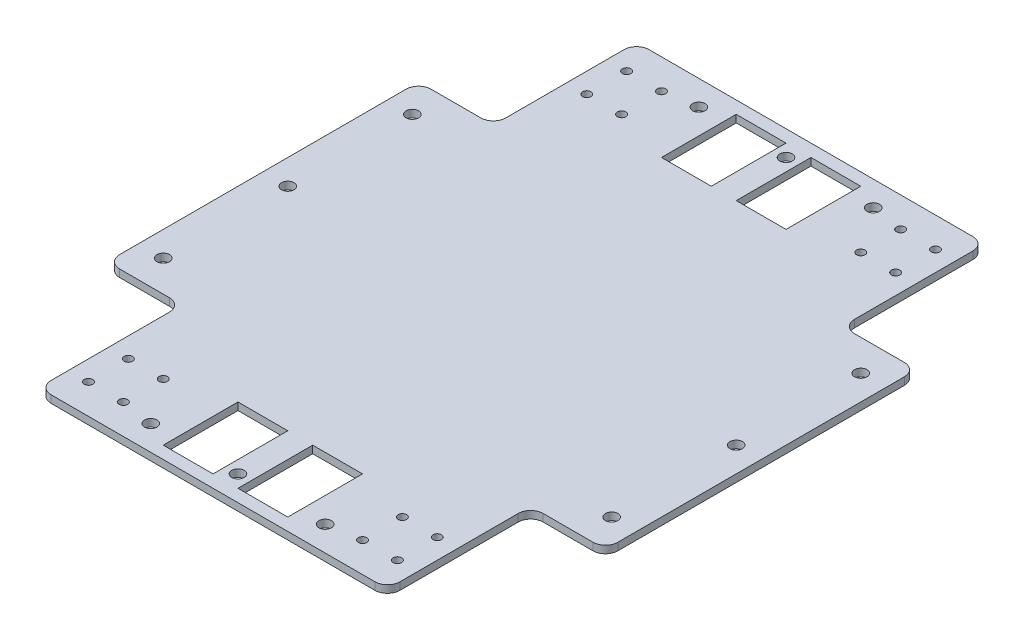
from build123d import *

# Parameters (mm, degrees)
SKETCH_1_R          = 1.7
SKETCH_1_R_2        = 2.5
SKETCH_1_W          = 20
SKETCH_1_H          = 30
EXTRUDE_2_DEPTH     = 3
SKETCH_3_W          = 30
SKETCH_3_H          = 10
CUT_EXTRUDE_2_DEPTH = 3


with BuildPart() as part:
    # 草图1 → 凸台-拉伸2 (new body)
    with BuildSketch(Plane(origin=(0, 0, 0), x_dir=(1, 0, 0), z_dir=(0, 1, 0))):
        with BuildLine():
            Line((-75, 80), (-95, 80))
            ThreePointArc((-95, 80), (-98.535533906, 78.535533906), (-100, 75))
            Line((-100, 75), (-100, -75))
            ThreePointArc((-100, -75), (-98.535533906, -78.535533906), (-95, -80))
            Line((-95, -80), (-75, -80))
            ThreePointArc((-75, -80), (-71.464466094, -81.464466094), (-70, -85))
            Line((-70, -85), (-70, -115))
            ThreePointArc((-70, -115), (-68.535533906, -118.535533906), (-65, -120))
            Line((-65, -120), (65, -120))
            ThreePointArc((65, -120), (68.535533906, -118.535533906), (70, -115))
            Line((70, -115), (70, -85))
            ThreePointArc((70, -85), (71.464466094, -81.464466094), (75, -80))
            Line((75, -80), (95, -80))
            ThreePointArc((95, -80), (98.535533906, -78.535533906), (100, -75))
            Line((100, -75), (100, 75))
            ThreePointArc((100, 75), (98.535533906, 78.535533906), (95, 80))
            Line((95, 80), (75, 80))
            ThreePointArc((75, 80), (71.464466094, 81.464466094), (70, 85))
            Line((70, 85), (70, 115))
            ThreePointArc((70, 115), (68.535533906, 118.535533906), (65, 120))
            Line((65, 120), (-65, 120))
            ThreePointArc((-65, 120), (-68.535533906, 118.535533906), (-70, 115))
            Line((-70, 115), (-70, 85))
            ThreePointArc((-70, 85), (-71.464466094, 81.464466094), (-75, 80))
        make_face()
        with Locations(Location((-62, -108, 0), (0, 0, 270))):
            Circle(SKETCH_1_R, mode=Mode.SUBTRACT)
        with Locations(Location((-48, -108, 0), (0, 0, 270))):
            Circle(SKETCH_1_R, mode=Mode.SUBTRACT)
        with Locations(Location((-62, -92, 0), (0, 0, 270))):
            Circle(SKETCH_1_R, mode=Mode.SUBTRACT)
        with Locations(Location((-48, -92, 0), (0, 0, 270))):
            Circle(SKETCH_1_R, mode=Mode.SUBTRACT)
        with Locations(Location((-35, -110, 0), (0, 0, 270))):
            Circle(SKETCH_1_R_2, mode=Mode.SUBTRACT)
        with Locations((-15, -100)):
            Rectangle(SKETCH_1_W, SKETCH_1_H, mode=Mode.SUBTRACT)
        with Locations(Location((-90, -50, 0), (0, 0, 270))):
            Circle(SKETCH_1_R_2, mode=Mode.SUBTRACT)
        with Locations(Location((0, -110, 0), (0, 0, 270))):
            Circle(SKETCH_1_R_2, mode=Mode.SUBTRACT)
        with Locations((15, -100)):
            Rectangle(SKETCH_1_W, SKETCH_1_H, mode=Mode.SUBTRACT)
        with Locations(Location((35, -110, 0), (0, 0, 270))):
            Circle(SKETCH_1_R_2, mode=Mode.SUBTRACT)
        with Locations(Location((48, -108, 0), (0, 0, 270))):
            Circle(SKETCH_1_R, mode=Mode.SUBTRACT)
        with Locations(Location((62, -108, 0), (0, 0, 270))):
            Circle(SKETCH_1_R, mode=Mode.SUBTRACT)
        with Locations(Location((48, -92, 0), (0, 0, 270))):
            Circle(SKETCH_1_R, mode=Mode.SUBTRACT)
        with Locations(Location((62, -92, 0), (0, 0, 270))):
            Circle(SKETCH_1_R, mode=Mode.SUBTRACT)
        with Locations(Location((90, -50, 0), (0, 0, 270))):
            Circle(SKETCH_1_R_2, mode=Mode.SUBTRACT)
        with Locations(Location((-90, 0, 0), (0, 0, 270))):
            Circle(SKETCH_1_R_2, mode=Mode.SUBTRACT)
        with Locations(Location((-90, 50, 0), (0, 0, 270))):
            Circle(SKETCH_1_R_2, mode=Mode.SUBTRACT)
        with Locations(Location((-62, 92, 0), (0, 0, 270))):
            Circle(SKETCH_1_R, mode=Mode.SUBTRACT)
        with Locations(Location((-62, 108, 0), (0, 0, 270))):
            Circle(SKETCH_1_R, mode=Mode.SUBTRACT)
        with Locations(Location((-48, 108, 0), (0, 0, 270))):
            Circle(SKETCH_1_R, mode=Mode.SUBTRACT)
        with Locations(Location((-48, 92, 0), (0, 0, 270))):
            Circle(SKETCH_1_R, mode=Mode.SUBTRACT)
        with Locations(Location((-35, 110, 0), (0, 0, 270))):
            Circle(SKETCH_1_R_2, mode=Mode.SUBTRACT)
        Polygon((-5, 115), (-5, 100), (-5, 85), (-25, 85), (-25, 115), align=None, mode=Mode.SUBTRACT)
        with Locations(Location((90, 0, 0), (0, 0, 270))):
            Circle(SKETCH_1_R_2, mode=Mode.SUBTRACT)
        with Locations(Location((90, 50, 0), (0, 0, 270))):
            Circle(SKETCH_1_R_2, mode=Mode.SUBTRACT)
        with Locations((15, 100)):
            Rectangle(SKETCH_1_W, SKETCH_1_H, mode=Mode.SUBTRACT)
        with Locations(Location((0, 110, 0), (0, 0, 270))):
            Circle(SKETCH_1_R_2, mode=Mode.SUBTRACT)
        with Locations(Location((35, 110, 0), (0, 0, 270))):
            Circle(SKETCH_1_R_2, mode=Mode.SUBTRACT)
        with Locations(Location((48, 92, 0), (0, 0, 270))):
            Circle(SKETCH_1_R, mode=Mode.SUBTRACT)
        with Locations(Location((62, 92, 0), (0, 0, 270))):
            Circle(SKETCH_1_R, mode=Mode.SUBTRACT)
        with Locations(Location((48, 108, 0), (0, 0, 270))):
            Circle(SKETCH_1_R, mode=Mode.SUBTRACT)
        with Locations(Location((62, 108, 0), (0, 0, 270))):
            Circle(SKETCH_1_R, mode=Mode.SUBTRACT)
    extrude(amount=EXTRUDE_2_DEPTH)

    # 草图3 → 切除-拉伸2 (cut)
    with BuildSketch(Plane(origin=(0, 3, 0), x_dir=(1, 0, 0), z_dir=(0, 1, 0))):
        with Locations((85, 80)):
            Rectangle(SKETCH_3_W, SKETCH_3_H)
        with BuildLine():
            Line((95, 62.5), (100, 62.5))
            Line((100, 62.5), (100, 75))
            Line((100, 75), (70, 75))
            Line((70, 75), (70, 67.5))
            ThreePointArc((70, 67.5), (71.464466094, 63.964466094), (75, 62.5))
            Line((75, 62.5), (95, 62.5))
        make_face()
        with BuildLine():
            Line((100, 57.5), (100, 62.5))
            Line((100, 62.5), (95, 62.5))
            ThreePointArc((95, 62.5), (98.535533906, 61.035533906), (100, 57.5))
        make_face()
        with Locations((-85, 80)):
            Rectangle(SKETCH_3_W, SKETCH_3_H)
        with BuildLine():
            Line((-70, 75), (-100, 75))
            Line((-100, 75), (-100, 62.5))
            Line((-100, 62.5), (-95, 62.5))
            Line((-95, 62.5), (-75, 62.5))
            ThreePointArc((-75, 62.5), (-71.464466094, 63.964466094), (-70, 67.5))
            Line((-70, 67.5), (-70, 75))
        make_face()
        with BuildLine():
            Line((-95, 62.5), (-100, 62.5))
            Line((-100, 62.5), (-100, 57.5))
            ThreePointArc((-100, 57.5), (-98.535533906, 61.035533906), (-95, 62.5))
        make_face()
        with BuildLine():
            Line((-95, -62.5), (-100, -62.5))
            Line((-100, -62.5), (-100, -75))
            Line((-100, -75), (-70, -75))
            Line((-70, -75), (-70, -67.5))
            ThreePointArc((-70, -67.5), (-71.464466094, -63.964466094), (-75, -62.5))
            Line((-75, -62.5), (-95, -62.5))
        make_face()
        with Locations((-85, -80)):
            Rectangle(SKETCH_3_W, SKETCH_3_H)
        with BuildLine():
            Line((-100, -57.5), (-100, -62.5))
            Line((-100, -62.5), (-95, -62.5))
            ThreePointArc((-95, -62.5), (-98.535533906, -61.035533906), (-100, -57.5))
        make_face()
        with Locations((85, -80)):
            Rectangle(SKETCH_3_W, SKETCH_3_H)
        with BuildLine():
            Line((70, -75), (100, -75))
            Line((100, -75), (100, -62.5))
            Line((100, -62.5), (95, -62.5))
            Line((95, -62.5), (75, -62.5))
            ThreePointArc((75, -62.5), (71.464466094, -63.964466094), (70, -67.5))
            Line((70, -67.5), (70, -75))
        make_face()
        with BuildLine():
            Line((95, -62.5), (100, -62.5))
            Line((100, -62.5), (100, -57.5))
            ThreePointArc((100, -57.5), (98.535533906, -61.035533906), (95, -62.5))
        make_face()
    extrude(amount=-CUT_EXTRUDE_2_DEPTH, mode=Mode.SUBTRACT)


solid = part.part
